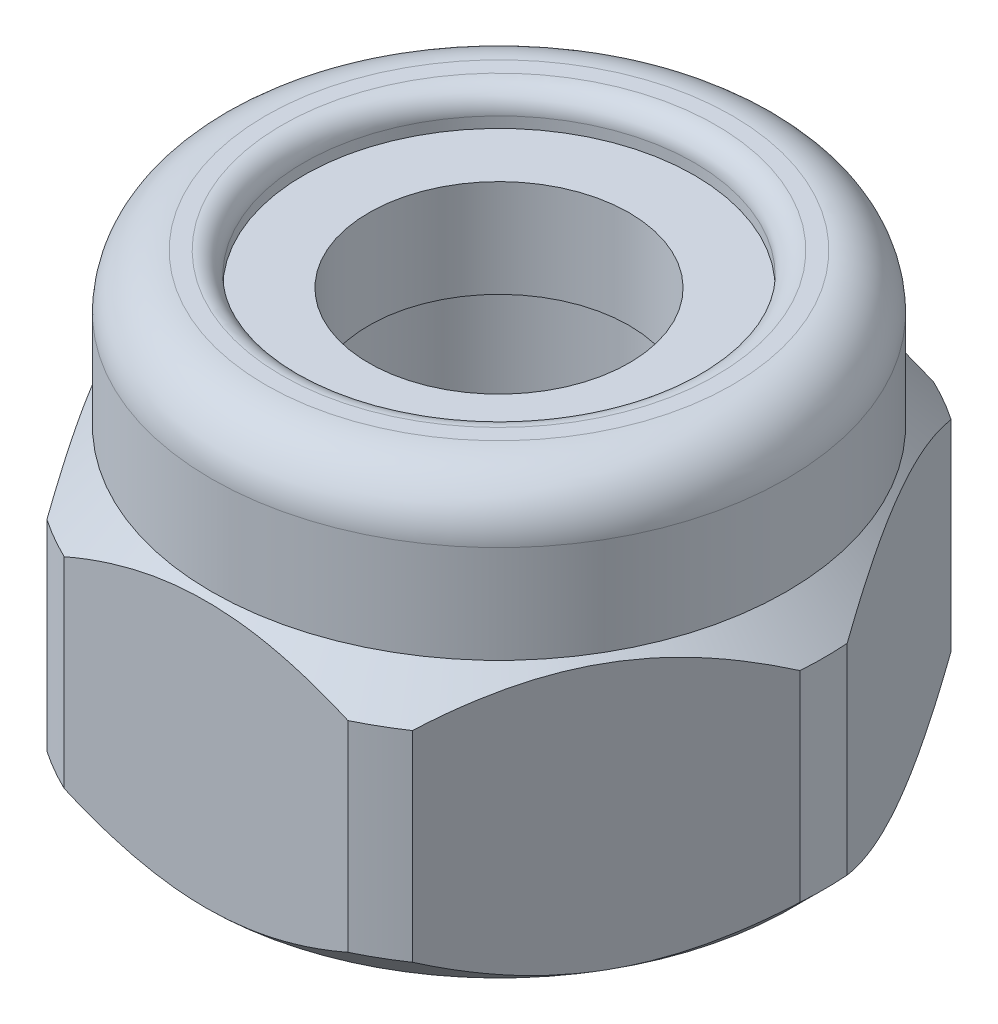
from build123d import *

# Parameters (mm, degrees)
SKETCH3_OUTSIDE_W     = 9.868
SKETCH3_OUTSIDE_H     = 9.868
CUT_EXTRUDE1_DEPTH    = 10
FILLET2_R             = 0.5
FILLET3_R             = 0.2
M3_TAPPED_HOLE4_D     = 2.5
M3_TAPPED_HOLE4_DEPTH = 21.5
M3_TAPPED_HOLE4_TIP   = 0.751075774
CHAMFER1_SIZE         = 0.3
SKETCH6_W             = 0.6
SKETCH6_H             = 0.9


with BuildPart() as part:
    # Sketch1 → Revolve1 (revolve)
    with BuildSketch(Plane.XY):
        Polygon((1, 0), (2.7, 0), (3, 0.3), (3, 2.15), (2.65, 2.5), (2.65, 3.9), (1.8, 3.9), (1.8, 2.7), (1, 2.7), align=None)
    revolve(axis=Axis((0, 0, 0), (0, 1, 0)))

    # Sketch3 outside → Cut-Extrude1 (cut)
    with BuildSketch(Plane(origin=(0, 3.9, 0), x_dir=(1, 0, 0), z_dir=(0, 1, 0))):
        Rectangle(SKETCH3_OUTSIDE_W, SKETCH3_OUTSIDE_H)
        Polygon((3.117691454, 0), (1.558845727, 2.7), (-1.558845727, 2.7), (-3.117691454, 0), (-1.558845727, -2.7), (1.558845727, -2.7), align=None, mode=Mode.SUBTRACT)
    extrude(amount=-CUT_EXTRUDE1_DEPTH, mode=Mode.SUBTRACT)

    # Fillet2
    fillet2_edges = [part.edges().sort_by_distance(p)[0] for p in [
        (-2.65, 3.9, 0),
    ]]
    fillet(fillet2_edges, radius=FILLET2_R)

    # Fillet3
    fillet3_edges = [part.edges().sort_by_distance(p)[0] for p in [
        (-1.8, 3.9, 0),
    ]]
    fillet(fillet3_edges, radius=FILLET3_R)

    # M3 Tapped Hole4
    with Locations(Plane(origin=(0, 0, 0), x_dir=(0, 0, -1), z_dir=(0, -1, 0))):
        with Locations((0, 0)):
            Hole(M3_TAPPED_HOLE4_D / 2, depth=M3_TAPPED_HOLE4_DEPTH)
            with Locations((0, 0, -(M3_TAPPED_HOLE4_DEPTH + M3_TAPPED_HOLE4_TIP / 2))):  # 118° drill point
                Cone(0, M3_TAPPED_HOLE4_D / 2, M3_TAPPED_HOLE4_TIP, mode=Mode.SUBTRACT)

    # Chamfer1
    chamfer1_edges = [part.edges().sort_by_distance(p)[0] for p in [
        (0, 0, -1.25),
    ]]
    chamfer(chamfer1_edges, length=CHAMFER1_SIZE)

    # Sketch6 → Revolve2 (revolve)
    with BuildSketch(Plane.XY):
        with Locations((-1.5, 3.15)):
            Rectangle(SKETCH6_W, SKETCH6_H)
    revolve(axis=Axis((0, 0, 0), (0, 1, 0)))


solid = part.part
